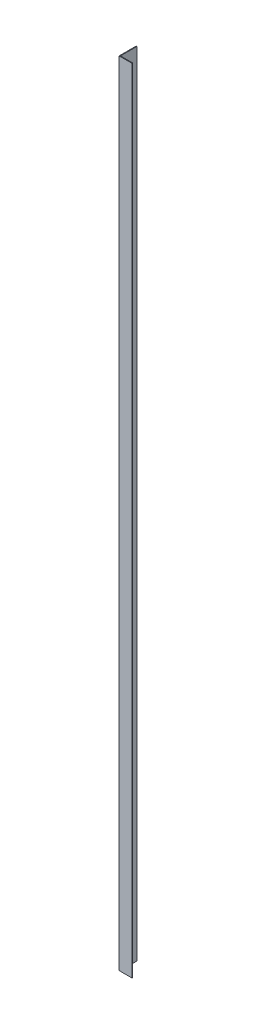
from build123d import *

# Parameters (mm, degrees)
OVEN_SOVE_SAG_1_START = 120
OVEN_SOVE_SAG_1_DEPTH = 1850


with BuildPart() as part:
    # Sketch1 → OVEN_sove_sag_1 (new body)
    with BuildSketch(Plane(origin=(0, 0, 0), x_dir=(1, 0, 0), z_dir=(0, 1, 0)).offset(OVEN_SOVE_SAG_1_START)):
        Polygon((700, -40), (700, -38.5), (671.5, -38.5), (671.5, 0), (670, 0), (670, -40), align=None)
    extrude(amount=OVEN_SOVE_SAG_1_DEPTH)


solid = part.part
